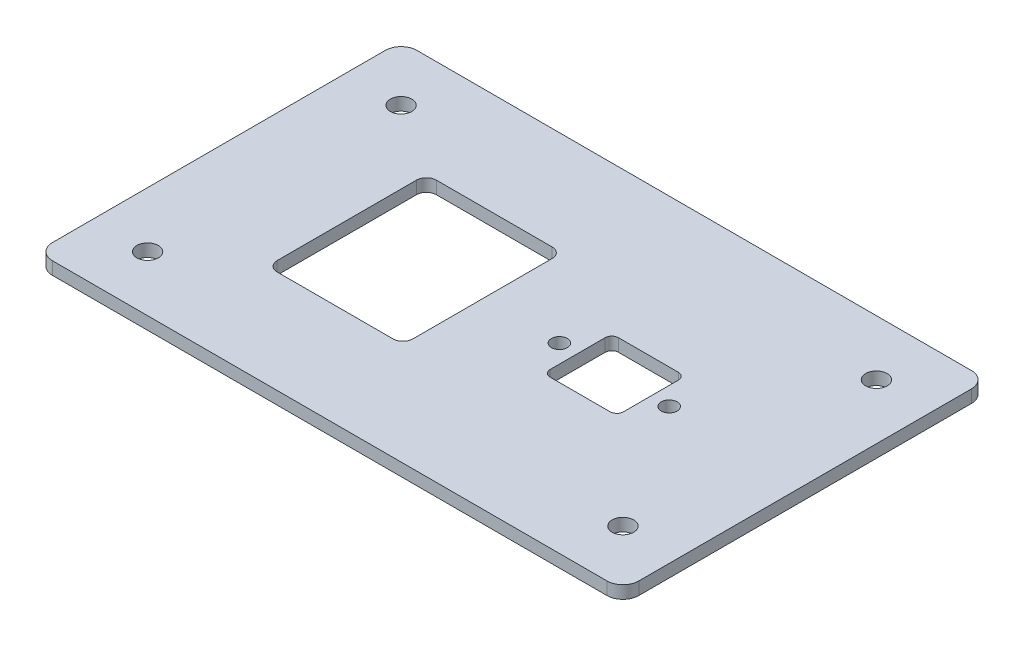
from build123d import *

# Parameters (mm, degrees)
SKETCH2_R           = 1.6
SKETCH2_R_2         = 2.15265
BOSS_EXTRUDE1_DEPTH = 2.54


with BuildPart() as part:
    # Sketch2 → Boss-Extrude1 (new body)
    with BuildSketch(Plane(origin=(0, 0, 0), x_dir=(1, 0, 0), z_dir=(0, 1, 0))):
        with BuildLine():
            Line((-55.5625, -36.5125), (55.5625, -36.5125))
            ThreePointArc((55.5625, -36.5125), (57.80756403, -35.58256403), (58.7375, -33.3375))
            Line((58.7375, -33.3375), (58.7375, 33.3375))
            ThreePointArc((58.7375, 33.3375), (57.80756403, 35.58256403), (55.5625, 36.5125))
            Line((55.5625, 36.5125), (-55.5625, 36.5125))
            ThreePointArc((-55.5625, 36.5125), (-57.80756403, 35.58256403), (-58.7375, 33.3375))
            Line((-58.7375, 33.3375), (-58.7375, -33.3375))
            ThreePointArc((-58.7375, -33.3375), (-57.80756403, -35.58256403), (-55.5625, -36.5125))
        make_face()
        with Locations(Location((9.5, 0, 0), (0, 0, 270))):
            Circle(SKETCH2_R, mode=Mode.SUBTRACT)
        with Locations(Location((31.5, 0, 0), (0, 0, 270))):
            Circle(SKETCH2_R, mode=Mode.SUBTRACT)
        with Locations(Location((47.625, 25.4, 0), (0, 0, 90))):
            Circle(SKETCH2_R_2, mode=Mode.SUBTRACT)
        with Locations(Location((47.625, -25.4, 0), (0, 0, 270))):
            Circle(SKETCH2_R_2, mode=Mode.SUBTRACT)
        with Locations(Location((-47.625, 25.4, 0), (0, 0, 270))):
            Circle(SKETCH2_R_2, mode=Mode.SUBTRACT)
        with Locations(Location((-47.625, -25.4, 0), (0, 0, 90))):
            Circle(SKETCH2_R_2, mode=Mode.SUBTRACT)
        with BuildLine():
            Line((14.5, -6.85), (26.5, -6.85))
            ThreePointArc((26.5, -6.85), (27.454594155, -6.454594155), (27.85, -5.5))
            Line((27.85, -5.5), (27.85, 5.5))
            ThreePointArc((27.85, 5.5), (27.454594155, 6.454594155), (26.5, 6.85))
            Line((26.5, 6.85), (14.5, 6.85))
            ThreePointArc((14.5, 6.85), (13.545405845, 6.454594155), (13.15, 5.5))
            Line((13.15, 5.5), (13.15, -5.5))
            ThreePointArc((13.15, -5.5), (13.545405845, -6.454594155), (14.5, -6.85))
        make_face(mode=Mode.SUBTRACT)
        with BuildLine():
            Line((-7.9, 15.95), (-31.1, 15.95))
            ThreePointArc((-31.1, 15.95), (-32.514213562, 15.364213562), (-33.1, 13.95))
            Line((-33.1, 13.95), (-33.1, -13.95))
            ThreePointArc((-33.1, -13.95), (-32.514213562, -15.364213562), (-31.1, -15.95))
            Line((-31.1, -15.95), (-7.9, -15.95))
            ThreePointArc((-7.9, -15.95), (-6.485786438, -15.364213562), (-5.9, -13.95))
            Line((-5.9, -13.95), (-5.9, 13.95))
            ThreePointArc((-5.9, 13.95), (-6.485786438, 15.364213562), (-7.9, 15.95))
        make_face(mode=Mode.SUBTRACT)
    extrude(amount=BOSS_EXTRUDE1_DEPTH)


solid = part.part
